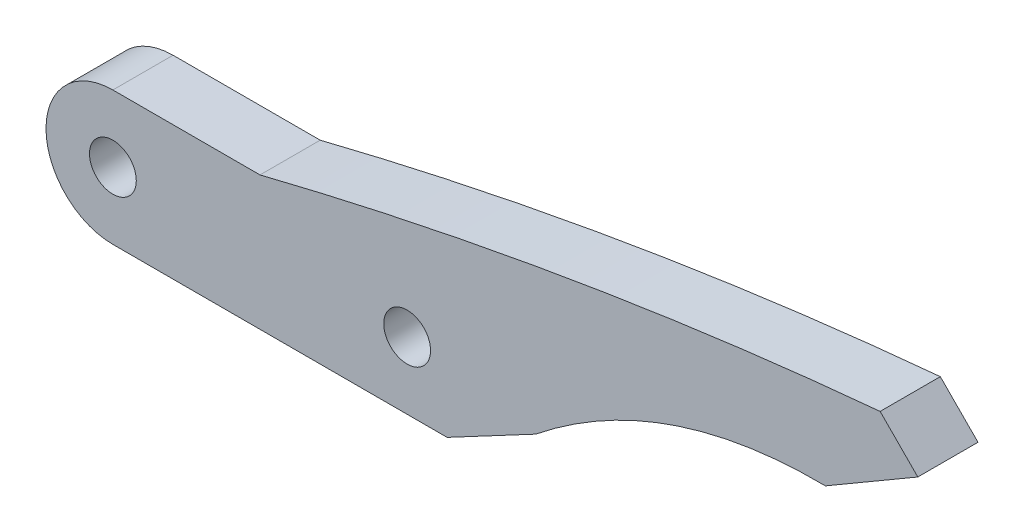
from build123d import *

# Parameters (mm, degrees)
SKETCH2_R           = 5
SKETCH2_R_2         = 1.75
BOSS_EXTRUDE1_DEPTH = 4.5
BOSS_EXTRUDE2_DEPTH = 4.5


with BuildPart() as part:
    # Sketch2 → Boss-Extrude1 (new body)
    # profile 1 of 3: a face of its own
    with BuildSketch(Plane.XY):
        with Locations((-11, 0)):
            Circle(SKETCH2_R)
        with Locations((-11, 0)):
            Circle(SKETCH2_R_2, mode=Mode.SUBTRACT)
    # profile 2 of 3: a face of its own
    with BuildSketch(Plane.XY):
        with Locations((11, 0)):
            Circle(SKETCH2_R)
        with Locations((11, 0)):
            Circle(SKETCH2_R_2, mode=Mode.SUBTRACT)
    # profile 3 of 3: a face of its own
    with BuildSketch(Plane.XY):
        with BuildLine():
            ThreePointArc((-6, 0), (-7.464466094, -3.535533906), (-11, -5))
            Line((-11, -5), (11, -5))
            ThreePointArc((11, -5), (6, -1e-09), (10.999999999, 5))
            Line((10.999999999, 5), (-11, 5))
            ThreePointArc((-11, 5), (-7.464466094, 3.535533906), (-6, 0))
        make_face()
    extrude(amount=-BOSS_EXTRUDE1_DEPTH)

    # Sketch3 → Boss-Extrude2 (add)
    with BuildSketch(Plane.XY):
        with BuildLine():
            Line((46.363989199, 12.87), (49.180795902, 10.03))
            Line((49.180795902, 10.03), (42.27, 6))
            add(Edge.make_bspline(
                [(42.27, 6), (30.146150748, 6.157348305), (20.61, -1.48)],
                knots=[0, 0, 0, 1, 1, 1], degree=2))
            Line((20.61, -1.48), (13.99, -5))
            Line((13.99, -5), (11, -5))
            ThreePointArc((11, -5), (16, 0), (11, 5))
            Line((11, 5), (0, 5))
            add(Edge.make_bspline(
                [(0, 5), (22.885517501, 10.707926651), (46.363989199, 12.87)],
                knots=[0, 0, 0, 1, 1, 1], degree=2))
        make_face()
    extrude(amount=-BOSS_EXTRUDE2_DEPTH)


solid = part.part
